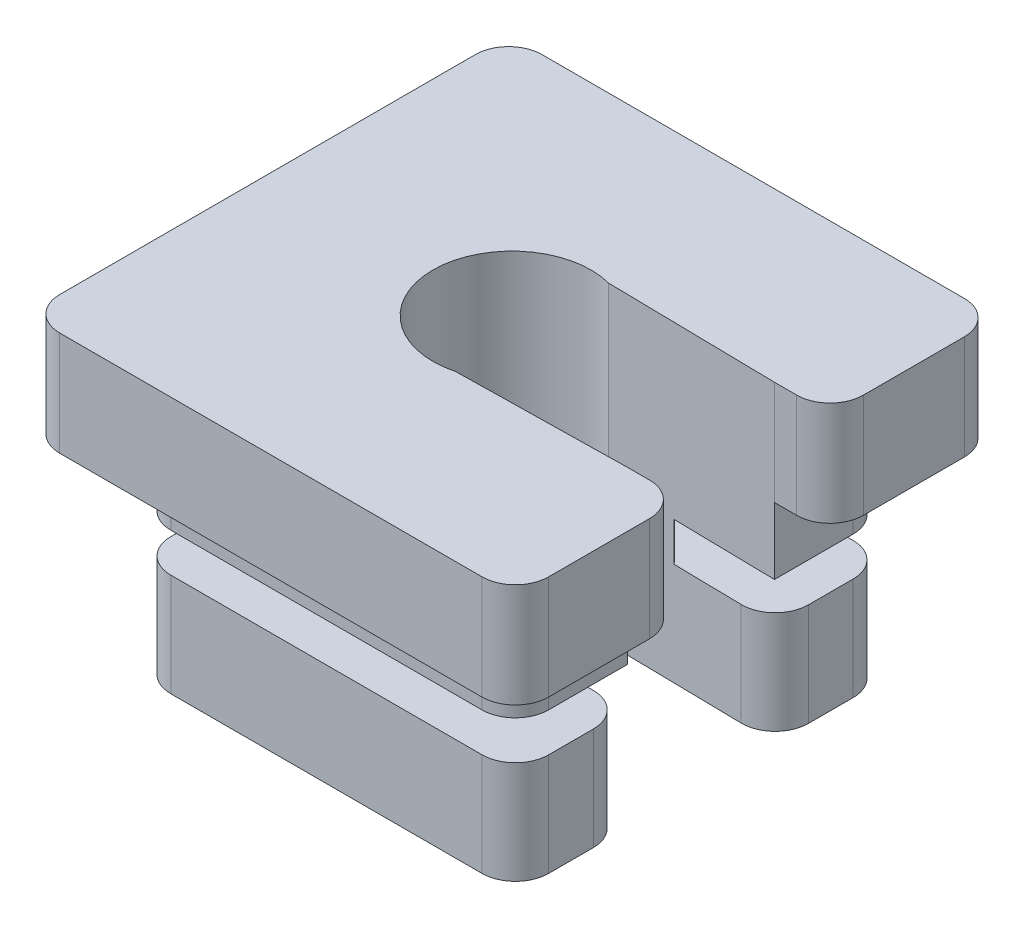
from build123d import *

# Parameters (mm, degrees)
BOSS_EXTRUDE1_DEPTH = 9.525
BOSS_EXTRUDE2_DEPTH = 4.7625
CUT_EXTRUDE1_DEPTH  = 1.778
FILLET1_R           = 1.524


with BuildPart() as part:
    # Sketch2 → Boss-Extrude1 (new body)
    with BuildSketch(Plane(origin=(0, 0, 0), x_dir=(1, 0, 0), z_dir=(0, 1, 0))):
        with BuildLine():
            Line((8.64, 8.4876), (-8.64, 8.4876))
            Line((-8.64, 8.4876), (-8.64, -8.4876))
            Line((-8.64, -8.4876), (8.64, -8.4876))
            Line((8.64, -8.4876), (8.64, -3.3655))
            Line((8.64, -3.3655), (0.921517153, -3.500226619))
            ThreePointArc((0.921517153, -3.500226619), (-3.6195, 0), (0.921517153, 3.500226619))
            Line((0.921517153, 3.500226619), (8.64, 3.3655))
            Line((8.64, 3.3655), (8.64, 8.4876))
        make_face()
    extrude(amount=BOSS_EXTRUDE1_DEPTH)

    # Sketch3 → Boss-Extrude2 (add)
    with BuildSketch(Plane(origin=(0, 9.525, 0), x_dir=(1, 0, 0), z_dir=(0, 1, 0))):
        with BuildLine():
            Line((11.18, 3.3655), (11.18, 11.0276))
            Line((11.18, 11.0276), (-11.18, 11.0276))
            Line((-11.18, 11.0276), (-11.18, -11.0276))
            Line((-11.18, -11.0276), (11.18, -11.0276))
            Line((11.18, -11.0276), (11.18, -3.3655))
            Line((11.18, -3.3655), (8.64, -3.3655))
            Line((8.64, -3.3655), (0.921517153, -3.500226619))
            ThreePointArc((0.921517153, -3.500226619), (-3.6195, 0), (0.921517153, 3.500226619))
            Line((0.921517153, 3.500226619), (8.64, 3.3655))
            Line((8.64, 3.3655), (11.18, 3.3655))
        make_face()
    extrude(amount=BOSS_EXTRUDE2_DEPTH)

    # Sketch4 → Cut-Extrude1 (cut)
    with BuildSketch(Plane(origin=(0, 6.477, 0), x_dir=(-1, 0, 0), z_dir=(0, -1, 0))):
        with BuildLine():
            Line((3.970210665, 3.447011476), (8.64, 3.447011476))
            Line((8.64, 3.447011476), (8.64, 8.4876))
            Line((8.64, 8.4876), (-8.64, 8.4876))
            Line((-8.64, 8.4876), (-8.64, 3.3655))
            Line((-8.64, 3.3655), (-3.970210665, 3.447011476))
            ThreePointArc((-3.970210665, 3.447011476), (0, 5.2578), (3.970210665, 3.447011476))
        make_face()
        with BuildLine():
            Line((3.970210665, -3.447011476), (8.64, -3.447011476))
            Line((8.64, -3.447011476), (8.64, -8.4876))
            Line((8.64, -8.4876), (-8.64, -8.4876))
            Line((-8.64, -8.4876), (-8.64, -3.3655))
            Line((-8.64, -3.3655), (-3.970210665, -3.447011476))
            ThreePointArc((-3.970210665, -3.447011476), (0, -5.2578), (3.970210665, -3.447011476))
        make_face()
    extrude(amount=CUT_EXTRUDE1_DEPTH, mode=Mode.SUBTRACT)

    # Fillet1
    fillet1_edges = [part.edges().sort_by_distance(p)[0] for p in [
        (8.64, 8.001, 8.4876),
        (-8.64, 8.001, 8.4876),
        (-8.64, 8.001, -8.4876),
        (8.64, 8.001, -8.4876),
        (11.18, 11.90625, -3.3655),
        (11.18, 11.90625, -11.0276),
        (-11.18, 11.90625, -11.0276),
        (-11.18, 11.90625, 11.0276),
        (11.18, 11.90625, 11.0276),
        (11.18, 11.90625, 3.3655),
        (8.64, 2.3495, -3.3655),
        (8.64, 2.3495, 3.3655),
        (8.64, 2.3495, 8.4876),
        (-8.64, 2.3495, 8.4876),
        (-8.64, 2.3495, -8.4876),
        (8.64, 2.3495, -8.4876),
    ]]
    fillet(fillet1_edges, radius=FILLET1_R)


solid = part.part
